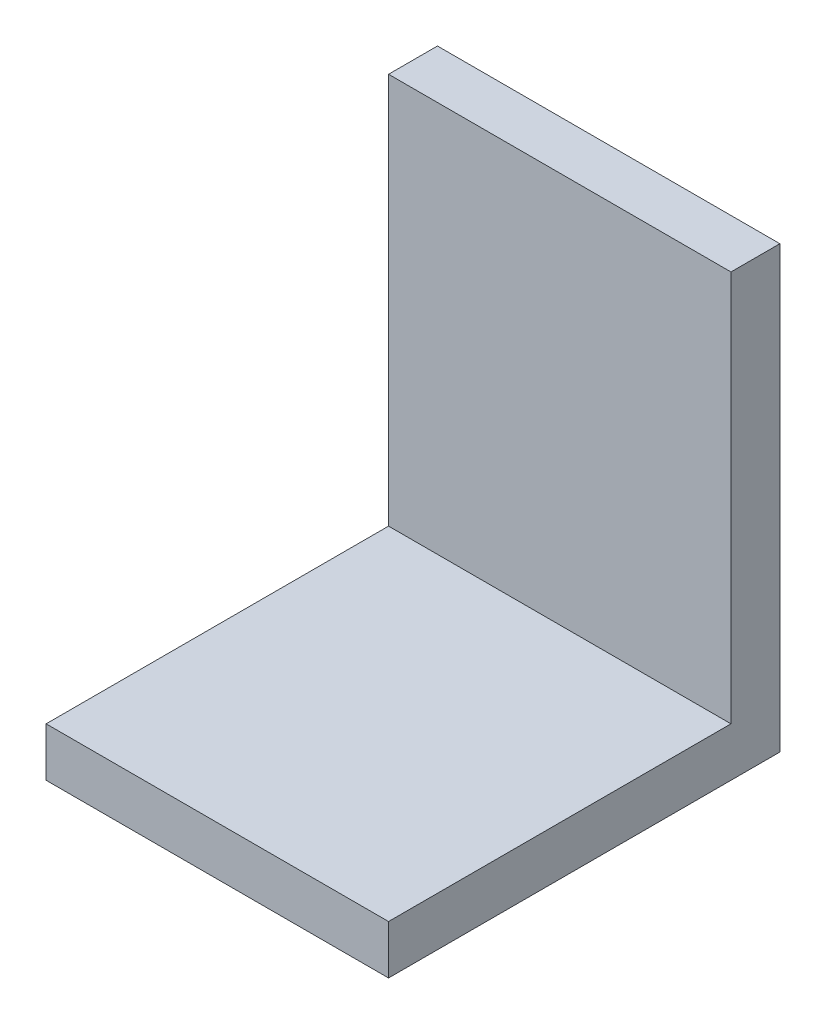
from build123d import *

# Parameters (mm, degrees)
SKETCH1_W           = 35
SKETCH1_H           = 40
BOSS_EXTRUDE1_DEPTH = 5
SKETCH2_W           = 35
SKETCH2_H           = 5
BOSS_EXTRUDE2_DEPTH = 40


with BuildPart() as part:
    # Sketch1 → Boss-Extrude1 (new body)
    with BuildSketch(Plane(origin=(0, 0, 0), x_dir=(1, 0, 0), z_dir=(0, 1, 0))):
        with Locations((29.763304318, 20)):
            Rectangle(SKETCH1_W, SKETCH1_H)
    extrude(amount=BOSS_EXTRUDE1_DEPTH)

    # Sketch2 → Boss-Extrude2 (add)
    with BuildSketch(Plane(origin=(0, 5, 0), x_dir=(1, 0, 0), z_dir=(0, 1, 0))):
        with Locations((29.763304318, 37.5)):
            Rectangle(SKETCH2_W, SKETCH2_H)
    extrude(amount=BOSS_EXTRUDE2_DEPTH)


solid = part.part
